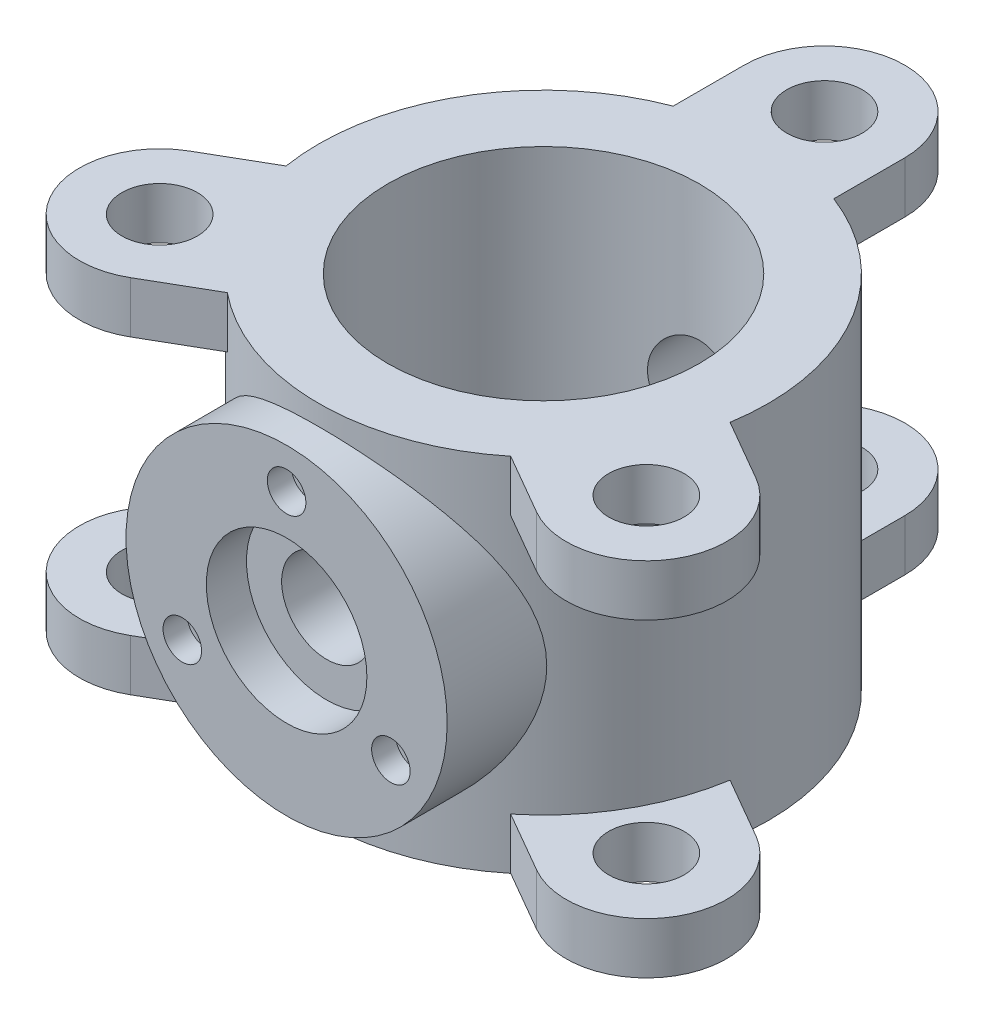
from build123d import *

# Parameters (mm, degrees)
SKETCH1_R                = 140
SKETCH1_R_2              = 97
BOSS_EXTRUDE1_DEPTH      = 225
SKETCH2_R                = 23.5
BOSS_EXTRUDE7_DEPTH      = 32
CIRPATTERN1_COUNT        = 3
MIRROR1_COPY_1_SKETCH_R  = 23.5
MIRROR1_COPY_1_DEPTH     = 32
MIRROR1_COPY_2_SKETCH_R  = 23.5
MIRROR1_COPY_2_DEPTH     = 32
BOSS_EXTRUDE8_REACH      = 491.361
BOSS_EXTRUDE8_END_RADIUS = 140
SKETCH3_R                = 100
SKETCH4_R                = 50
CUT_EXTRUDE1_DEPTH       = 25
SKETCH5_R                = 28.1
CUT_EXTRUDE2_DEPTH       = 490.361006427
SKETCH6_R                = 12
CUT_EXTRUDE3_DEPTH       = 15
CIRPATTERN2_COUNT        = 3


with BuildPart() as part:
    # Sketch1 → Boss-Extrude1 (new body)
    with BuildSketch(Plane(origin=(0, 0, 0), x_dir=(1, 0, 0), z_dir=(0, 1, 0))):
        with Locations(Location((0, 0, 0), (0, 0, 270))):
            Circle(SKETCH1_R)
        with Locations(Location((0, 0, 0), (0, 0, 270))):
            Circle(SKETCH1_R_2, mode=Mode.SUBTRACT)
    extrude(amount=BOSS_EXTRUDE1_DEPTH)

    # Sketch2 → Boss-Extrude7 (add)
    with BuildSketch(Plane(origin=(0, 225, 0), x_dir=(1, 0, 0), z_dir=(0, 1, 0))):
        with BuildLine():
            Line((-50, 175), (-50, 99.433076852))
            Line((-50, 99.433076852), (50, 99.433076852))
            Line((50, 99.433076852), (50, 175))
            ThreePointArc((50, 175), (0, 225), (-50, 175))
        make_face()
        with Locations(Location((0, 175, 0), (0, 0, 270))):
            Circle(SKETCH2_R, mode=Mode.SUBTRACT)
    boss_extrude7 = extrude(amount=-BOSS_EXTRUDE7_DEPTH)

    # CirPattern1: Boss-Extrude7 ×3 about axis
    cirpattern1_axis = Axis((0, 0, 0), (0, 1, 0))
    for i in range(1, CIRPATTERN1_COUNT):
        add(boss_extrude7.rotate(cirpattern1_axis, i * 360 / CIRPATTERN1_COUNT))

    # Mirror1: Boss-Extrude7 across plane
    add(boss_extrude7.mirror(Plane.ZX.offset(112.5)))

    # Mirror1 copy 1 sketch → Mirror1 copy 1 (add)
    with BuildSketch(Plane(origin=(0, 0, 0), x_dir=(-0.4999999999999998, 0, -0.8660254037844387), z_dir=(0, -1, 0))):
        with BuildLine():
            Line((-50, -175), (-50, -99.433076852))
            Line((-50, -99.433076852), (50, -99.433076852))
            Line((50, -99.433076852), (50, -175))
            ThreePointArc((50, -175), (0, -225), (-50, -175))
        make_face()
        with Locations((0, -175)):
            Circle(MIRROR1_COPY_1_SKETCH_R, mode=Mode.SUBTRACT)
    extrude(amount=-MIRROR1_COPY_1_DEPTH)

    # Mirror1 copy 2 sketch → Mirror1 copy 2 (add)
    with BuildSketch(Plane(origin=(0, 0, 0), x_dir=(-0.5000000000000004, 0, 0.8660254037844384), z_dir=(0, -1, 0))):
        with BuildLine():
            Line((-50, -175), (-50, -99.433076852))
            Line((-50, -99.433076852), (50, -99.433076852))
            Line((50, -99.433076852), (50, -175))
            ThreePointArc((50, -175), (0, -225), (-50, -175))
        make_face()
        with Locations((0, -175)):
            Circle(MIRROR1_COPY_2_SKETCH_R, mode=Mode.SUBTRACT)
    extrude(amount=-MIRROR1_COPY_2_DEPTH)

    # Boss-Extrude8: up to this cylinder (the profile starts outside it)
    boss_extrude8_end = Plane(origin=(0, 112.5, 0), z_dir=(0, -1, 0)) * Cylinder(BOSS_EXTRUDE8_END_RADIUS, 1263.722, mode=Mode.PRIVATE)
    # Sketch3 → Boss-Extrude8 (add, up to the surface)
    with BuildSketch(Plane.XY.offset(160), mode=Mode.PRIVATE) as boss_extrude8_sk1:
        with Locations((0, 112.5)):
            Circle(SKETCH3_R)
    boss_extrude8_tool1 = extrude(boss_extrude8_sk1.sketch, amount=-BOSS_EXTRUDE8_REACH, mode=Mode.PRIVATE) - boss_extrude8_end
    add(boss_extrude8_tool1.solids().sort_by_distance((0, 112.5, 160))[0])

    # Sketch4 → Cut-Extrude1 (cut)
    with BuildSketch(Plane.XY.offset(160)):
        with Locations((0, 112.5)):
            Circle(SKETCH4_R)
    extrude(amount=-CUT_EXTRUDE1_DEPTH, mode=Mode.SUBTRACT)

    # Sketch5 → Cut-Extrude2 (cut, through all)
    with BuildSketch(Plane.XY.offset(160)):
        with Locations((0, 112.5)):
            Circle(SKETCH5_R)
    extrude(amount=-CUT_EXTRUDE2_DEPTH, mode=Mode.SUBTRACT)

    # Sketch6 → Cut-Extrude3 (cut)
    with BuildSketch(Plane.XY.offset(160)):
        with Locations((0, 187.5)):
            Circle(SKETCH6_R)
    cut_extrude3 = extrude(amount=-CUT_EXTRUDE3_DEPTH, mode=Mode.SUBTRACT)

    # CirPattern2: Cut-Extrude3 ×3 about axis
    cirpattern2_axis = Axis((0, 112.5, 0), (0, 0, 1))
    for i in range(1, CIRPATTERN2_COUNT):
        add(cut_extrude3.rotate(cirpattern2_axis, i * 360 / CIRPATTERN2_COUNT), mode=Mode.SUBTRACT)


solid = part.part
